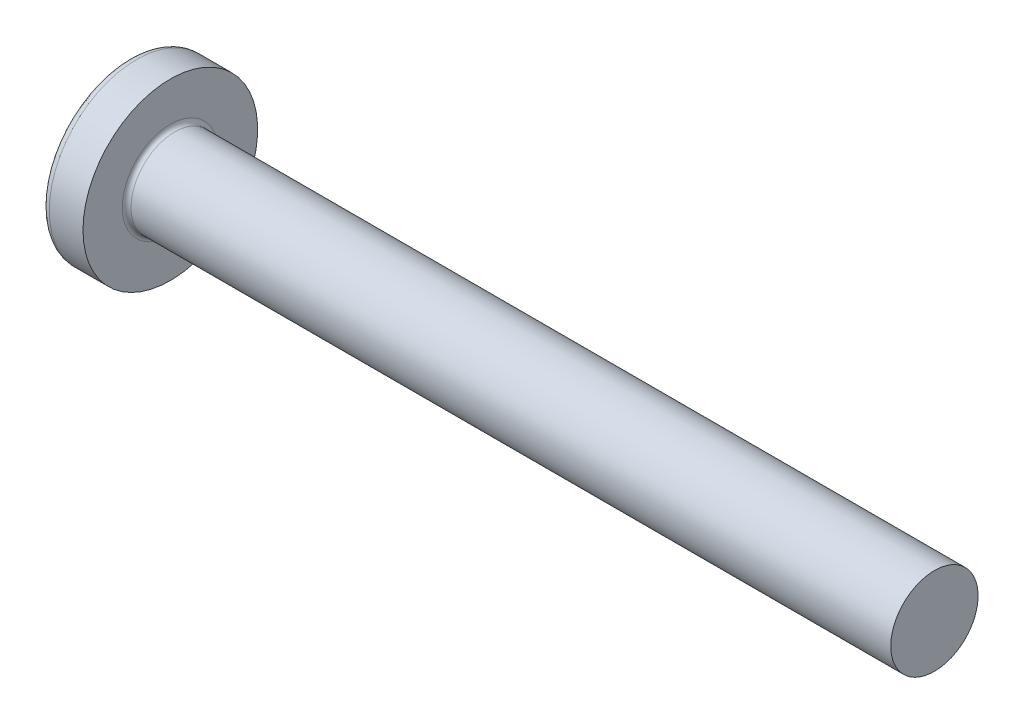
from build123d import *

# Parameters (mm, degrees)
FILLET1_R    = 0.2
RECPAT_COUNT = 2
RECPAT_ANGLE = 90


with BuildPart() as part:
    # BodySke → Base-Revolve (revolve)
    with BuildSketch(Plane.XY, mode=Mode.PRIVATE) as base_revolve_sk:
        with BuildLine():
            Line((3.1, 2), (3.1, 4))
            Line((3.1, 4), (1.555305874, 4))
            ThreePointArc((1.555305874, 4), (1.392873227, 3.961271902), (1.265388955, 3.853420195))
            ThreePointArc((1.265388955, 3.853420195), (0.324444487, 2.027933456), (0, 0))
            Line((0, 0), (38.1, 0))
            Line((38.1, 0), (38.1, 2))
            Line((38.1, 2), (3.1, 2))
        make_face()
    revolve(base_revolve_sk.sketch.rotate(Axis((1.555305874, 0, 0), (1, 0, 0)), 90), axis=Axis((1.555305874, 0, 0), (1, 0, 0)))

    # Fillet1
    fillet1_edges = [part.edges().sort_by_distance(p)[0] for p in [
        (3.1, 0, -2),
    ]]
    fillet(fillet1_edges, radius=FILLET1_R)

    # Sketch3 → Recess section 0
    with BuildSketch(Plane(origin=(0, 0, 0), x_dir=(0, 0, -1), z_dir=(1, 0, 0))):
        with BuildLine():
            Line((0.515, -2.15), (-0.515, -2.15))
            Line((-0.515, -2.15), (-0.515, 2.15))
            Line((-0.515, 2.15), (0.515, 2.15))
            Line((0.515, 2.15), (0.515, -2.15))
        make_face()
    # Sketch4 → Recess section 1
    with BuildSketch(Plane(origin=(2.34, 0, 0), x_dir=(0, 0, -1), z_dir=(1, 0, 0))):
        with BuildLine():
            Line((0.515, -0.983319232), (-0.515, -0.983319232))
            Line((-0.515, -0.983319232), (-0.515, 0.983319232))
            Line((-0.515, 0.983319232), (0.515, 0.983319232))
            Line((0.515, 0.983319232), (0.515, -0.983319232))
        make_face()
    recess = loft(mode=Mode.SUBTRACT)

    # RecPat: Recess ×2 about axis
    recpat_axis = Axis((0, 0, 0), (1, 0, 0))
    for i in range(1, RECPAT_COUNT):
        add(recess.rotate(recpat_axis, i * RECPAT_ANGLE / (RECPAT_COUNT - 1)), mode=Mode.SUBTRACT)

    # RecCorSke → RecessCore (revolve, cut)
    with BuildSketch(Plane.XY, mode=Mode.PRIVATE) as recesscore_sk:
        Polygon((0, 0), (0, 1.01462874), (2.34, 0.851), (2.616506661, 0), align=None)
    revolve(recesscore_sk.sketch.rotate(Axis((-3.175, 0, 0), (1, 0, 0)), 14.547591759), axis=Axis((-3.175, 0, 0), (1, 0, 0)), mode=Mode.SUBTRACT)


solid = part.part
